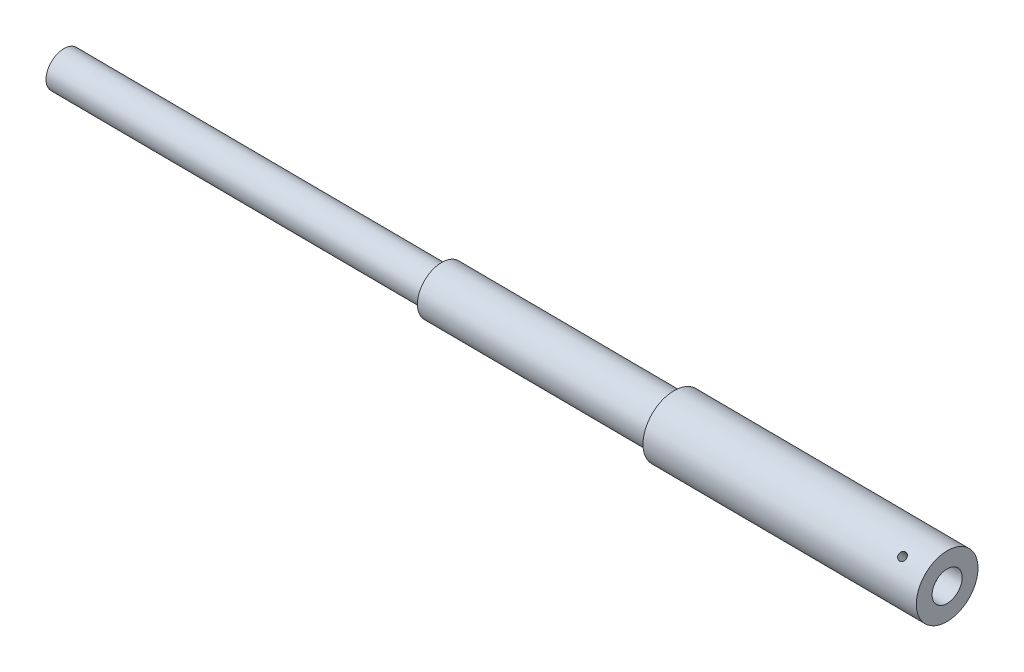
from build123d import *

# Parameters (mm, degrees)
SWEEP1_PROFILE_R        = 300
SWEEP2_PROFILE_R        = 406.4
SWEEP3_PROFILE_R        = 520.7
SKETCH96_R              = 65.57064834
CUT_EXTRUDE1_DEPTH      = 3000
CUT_EXTRUDE2_DEPTH      = 14988.534162474
CUT_EXTRUDE2_DEPTH_BACK = 14988.534162474
SKETCH97_R              = 254


with BuildPart() as part:
    # Sweep1: sweep along a path in Sketch1
    with BuildLine(Plane.XY) as sweep1_path:
        Line((-92984.258788215, 1591.662495116), (-78081.160966393, 1488.323407048))
    # Sweep1 profile (on start of the path) → Sweep1 (sweep)
    with BuildSketch(Plane(origin=(-92984.258788215, 1591.662495116, 0), x_dir=(0.00693390092814686, 0.9999759602200039, 0), z_dir=(0.9999759602200039, -0.00693390092814686, 0))):
        Circle(SWEEP1_PROFILE_R)
    sweep(path=sweep1_path.line)

    # Sweep2: sweep along a path in Sketch18
    with BuildLine(Plane.XY) as sweep2_path:
        Line((-86611.796586025, 1547.47541129), (-78081.160966393, 1488.323407048))
    # Sweep2 profile (on start of the path) → Sweep2 (sweep)
    with BuildSketch(Plane(origin=(-86611.796586025, 1547.47541129, 0), x_dir=(0.006933900928146876, 0.9999759602200038, 0), z_dir=(0.9999759602200038, -0.006933900928146876, 0))):
        Circle(SWEEP2_PROFILE_R)
    sweep(path=sweep2_path.line)

    # Sweep3: sweep along a path in Sketch79
    with BuildLine(Plane.XY) as sweep3_path:
        Line((-82692.035001146, 1520.2955194), (-78081.160966393, 1488.323407048))
    # Sweep3 profile (on start of the path) → Sweep3 (sweep)
    with BuildSketch(Plane(origin=(-82692.035001146, 1520.2955194, 0), x_dir=(0.006933900928146895, 0.9999759602200038, 0), z_dir=(0.9999759602200038, -0.006933900928146895, 0))):
        Circle(SWEEP3_PROFILE_R)
    sweep(path=sweep3_path.line)

    # Sketch96 → Cut-Extrude1 (cut, symmetric)
    with BuildSketch(Plane(origin=(-1329.649342872, 16090.326379674, -14618.529062171), x_dir=(0.9606474516301055, 0.17774002711559994, -0.21345949601160855), z_dir=(0.005247183588808439, 0.7567251828430883, 0.6537120656034123))):
        with Locations(Location((-79846.413589942, 1633.478101155, 0), (0, 0, 253.875539532))):
            Circle(SKETCH96_R)
    extrude(amount=CUT_EXTRUDE1_DEPTH, both=True, mode=Mode.SUBTRACT)

    # Sketch97 → Cut-Extrude2 (cut, two sides: drawn at the far end of the back side and taken through both)
    with BuildSketch(Plane(origin=(-92990.824364442, 644.804664332, 0), x_dir=(0, 0, 1), z_dir=(-0.9999759602200039, 0.0069339009281468664, 0)).offset(-CUT_EXTRUDE2_DEPTH_BACK)):
        with Locations(Location((0, 946.880593585, 0), (0, 0, 90))):
            Circle(SKETCH97_R)
    extrude(amount=CUT_EXTRUDE2_DEPTH + CUT_EXTRUDE2_DEPTH_BACK, mode=Mode.SUBTRACT)


solid = part.part
